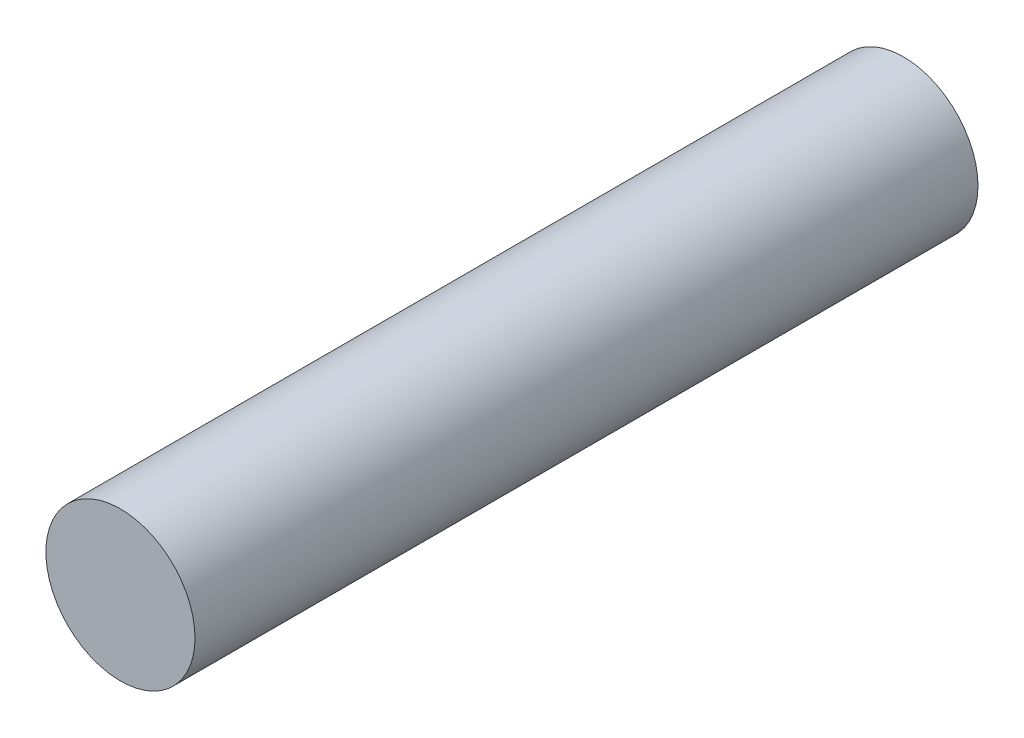
from build123d import *

# Parameters (mm, degrees)
SKETCH2_R           = 12.7
BOSS_EXTRUDE1_DEPTH = 133.35


with BuildPart() as part:
    # Sketch2 → Boss-Extrude1 (new body)
    with BuildSketch(Plane.XY):
        Circle(SKETCH2_R)
    extrude(amount=BOSS_EXTRUDE1_DEPTH)


solid = part.part
